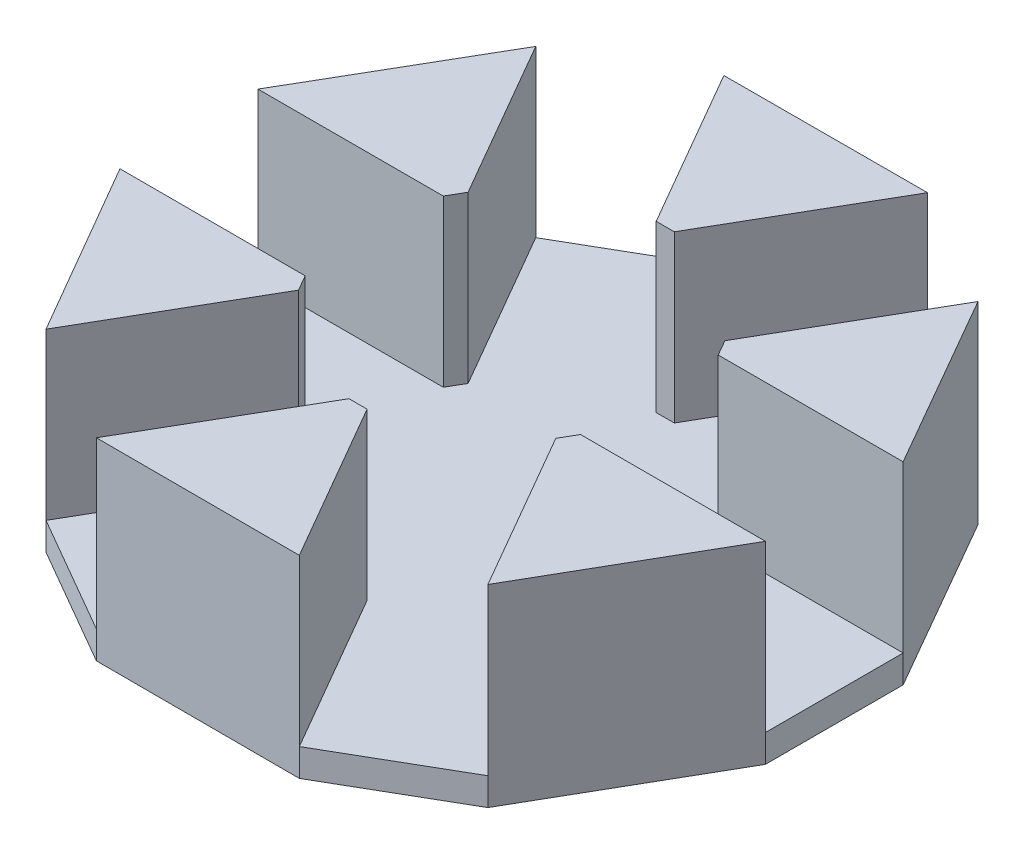
from build123d import *

# Parameters (mm, degrees)
BOSS_EXTRUDE1_DEPTH = 2.5
BOSS_EXTRUDE2_DEPTH = 15


with BuildPart() as part:
    # Sketch1 → Boss-Extrude1 (new body)
    with BuildSketch(Plane(origin=(0, 0, 0), x_dir=(1, 0, 0), z_dir=(0, 1, 0))):
        Polygon((443.467960434, -135.912167949), (443.467960434, -148.412314407), (452.699844164, -164.341477869), (463.501071842, -170.577558199), (481.912073973, -170.607993214), (492.737508483, -164.357902881), (501.91660162, -148.398260812), (501.916753351, -135.925543562), (492.738048515, -119.96567817), (481.912449677, -113.71552717), (463.501448438, -113.746497393), (452.699844164, -119.983004487), align=None)
    extrude(amount=-BOSS_EXTRUDE1_DEPTH)

    # Sketch1<12> → Boss-Extrude2 (add)
    with BuildSketch(Plane(origin=(0, 0, 0), x_dir=(1, 0, 0), z_dir=(0, 1, 0))):
        Polygon((443.467960434, -148.412314407), (452.699844164, -164.341477869), (461.073568615, -149.83773521), (460.250524065, -148.418039508), align=None)
        Polygon((471.874796293, -156.07381554), (463.501071842, -170.577558199), (481.912073973, -170.607993214), (473.515811116, -156.076742585), align=None)
        Polygon((452.699844164, -119.983004487), (443.467960434, -135.912167949), (460.250524065, -135.906442848), (461.073568615, -134.486747146), align=None)
        Polygon((484.351161781, -149.820927135), (492.737508483, -164.357902881), (501.91660162, -148.398260812), (485.169129802, -148.398300503), align=None)
        Polygon((481.912449677, -113.71552717), (463.501448438, -113.746497393), (471.875594509, -128.249996622), (473.516609246, -128.247021872), align=None)
        Polygon((485.169281539, -135.925096404), (501.916753351, -135.925543562), (492.738048515, -119.96567817), (484.351348131, -134.502449871), align=None)
    extrude(amount=BOSS_EXTRUDE2_DEPTH)


solid = part.part
